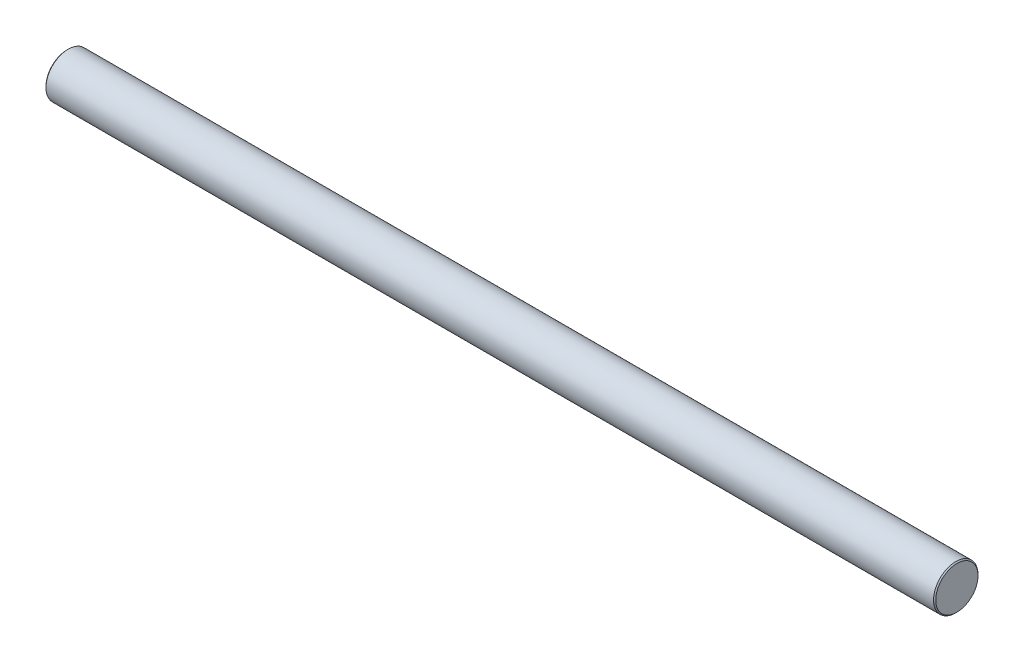
from build123d import *

# Parameters (mm, degrees)
CROQUIS1_R              = 1
SALIENTE_EXTRUIR1_DEPTH = 40
CHAFL_N1_SIZE           = 0.05


with BuildPart() as part:
    # Croquis1 → Saliente-Extruir1 (new body)
    with BuildSketch(Plane(origin=(0, 0, 0), x_dir=(0, 0, -1), z_dir=(1, 0, 0))):
        Circle(CROQUIS1_R)
    extrude(amount=SALIENTE_EXTRUIR1_DEPTH)

    # Chaflán1
    chafl_n1_edges = [part.edges().sort_by_distance(p)[0] for p in [
        (0, 0, 1),
        (40, 0, 1),
    ]]
    chamfer(chafl_n1_edges, length=CHAFL_N1_SIZE)


solid = part.part
